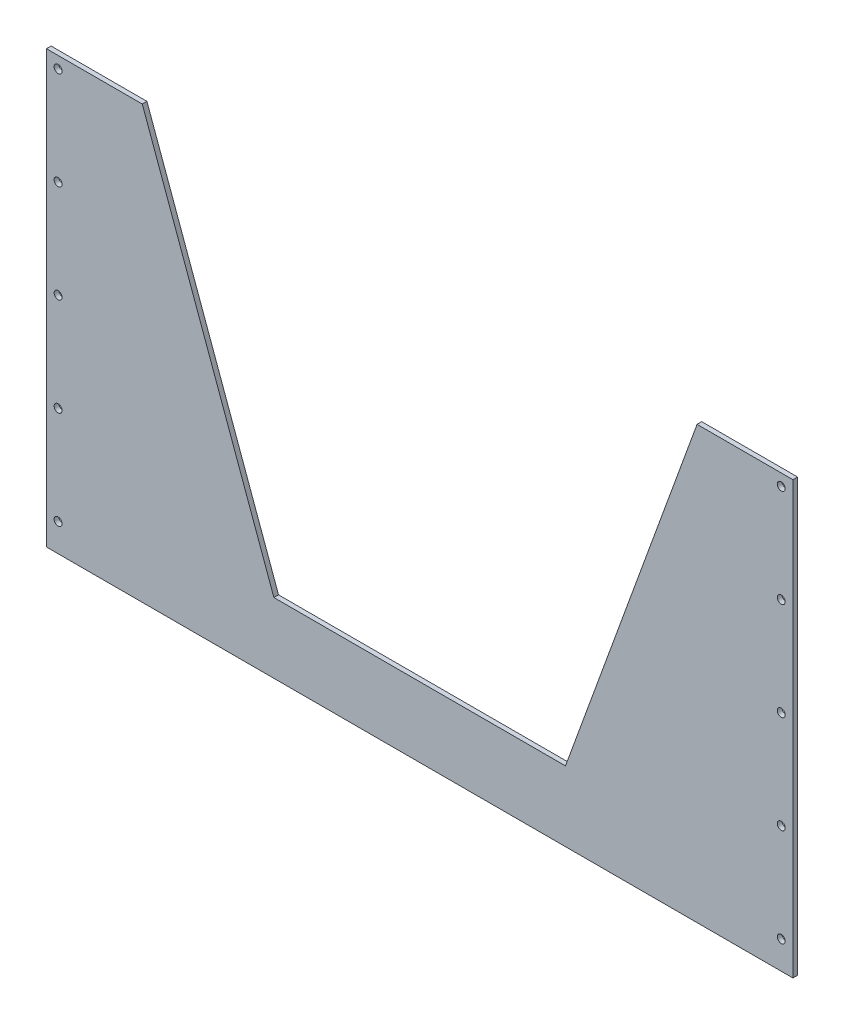
from build123d import *

# Parameters (mm, degrees)
EXTRUDE_1_DEPTH     = 1
SKETCH_2_R          = 1.7
CUT_EXTRUDE_1_DEPTH = 10


with BuildPart() as part:
    # Эскиз1 → Бобышка-Вытянуть1 (new, symmetric)
    with BuildSketch(Plane.XY):
        Polygon((-118.915386311, 92.5), (-62.5, -62.5), (62.5, -62.5), (118.915386311, 92.5), (160, 92.5), (160, -92.5), (-160, -92.5), (-160, 92.5), align=None)
    extrude(amount=EXTRUDE_1_DEPTH, both=True)

    # Эскиз2 → Вырез-Вытянуть1 (cut)
    with BuildSketch(Plane.XY.offset(1)):
        with Locations((-155, 87.5)):
            Circle(SKETCH_2_R)
        with Locations((-155, 45.5)):
            Circle(SKETCH_2_R)
        with Locations((-155, 3.5)):
            Circle(SKETCH_2_R)
        with Locations((-155, -38.5)):
            Circle(SKETCH_2_R)
        with Locations((-155, -80.5)):
            Circle(SKETCH_2_R)
        with Locations((155, -80.5)):
            Circle(SKETCH_2_R)
        with Locations((155, -38.5)):
            Circle(SKETCH_2_R)
        with Locations((155, 3.5)):
            Circle(SKETCH_2_R)
        with Locations((155, 45.5)):
            Circle(SKETCH_2_R)
        with Locations((155, 87.5)):
            Circle(SKETCH_2_R)
    extrude(amount=-CUT_EXTRUDE_1_DEPTH, mode=Mode.SUBTRACT)


solid = part.part
